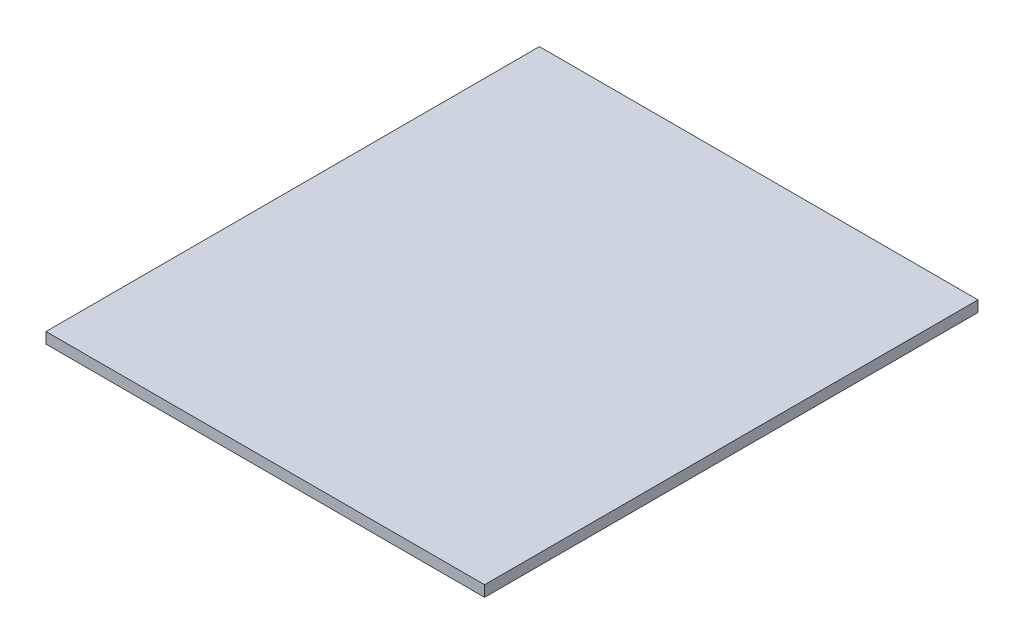
from build123d import *

# Parameters (mm, degrees)
ESQUISSE1_W        = 400
ESQUISSE1_H        = 450
BOSS_EXTRU_1_DEPTH = 10


with BuildPart() as part:
    # Esquisse1 → Boss.-Extru.1 (new body)
    with BuildSketch(Plane(origin=(0, 0, 0), x_dir=(1, 0, 0), z_dir=(0, 1, 0))):
        with Locations((-200, 225)):
            Rectangle(ESQUISSE1_W, ESQUISSE1_H)
    extrude(amount=BOSS_EXTRU_1_DEPTH)


solid = part.part
